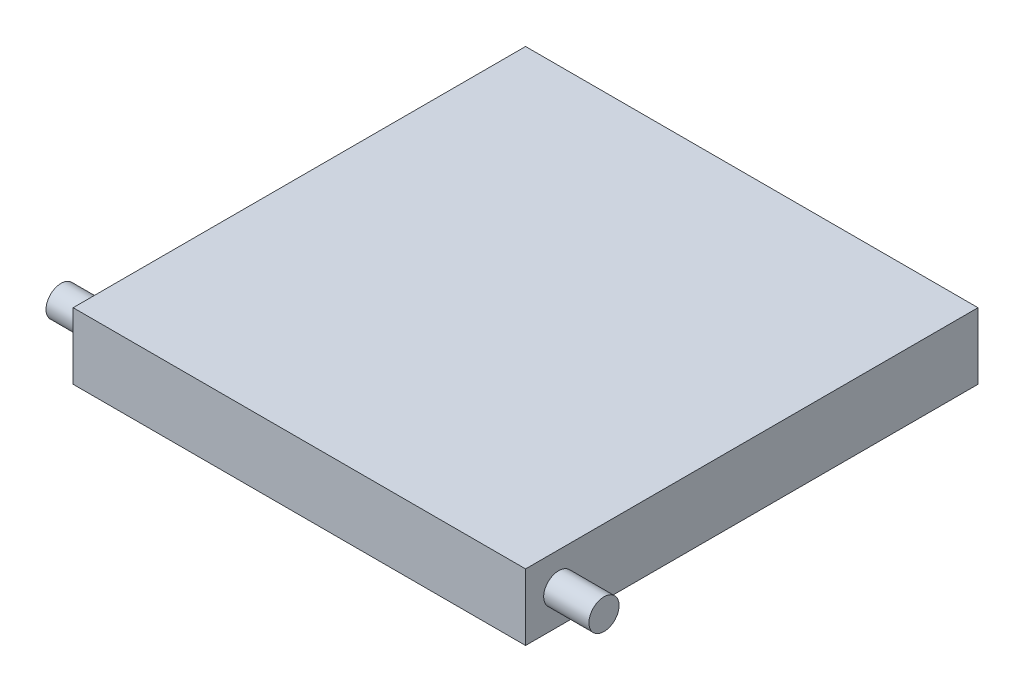
from build123d import *

# Parameters (mm, degrees)
ESQUISSE1_W        = 150
ESQUISSE1_H        = 150
BOSS_EXTRU_1_DEPTH = 22
BOSS_EXTRU_2_DEPTH = 15
BOSS_EXTRU_3_START = 15
ESQUISSE6_R        = 5
BOSS_EXTRU_3_DEPTH = 15


with BuildPart() as part:
    # Esquisse1 → Boss.-Extru.1 (new body)
    with BuildSketch(Plane(origin=(0, 0, 0), x_dir=(1, 0, 0), z_dir=(0, 1, 0))):
        Rectangle(ESQUISSE1_W, ESQUISSE1_H)
    extrude(amount=BOSS_EXTRU_1_DEPTH)

    # Esquisse2 → Boss.-Extru.2 (add)
    with BuildSketch(Plane(origin=(75, 0, 0), x_dir=(0, 0, -1), z_dir=(1, 0, 0))):
        with BuildLine():
            ThreePointArc((-64, 16), (-69, 11), (-64, 6))
            Line((-64, 6), (-64, 16))
        make_face()
        with BuildLine():
            Line((-64, 16), (-64, 6))
            ThreePointArc((-64, 6), (-60.464466094, 7.464466094), (-59, 11))
            ThreePointArc((-59, 11), (-60.464466094, 14.535533906), (-64, 16))
        make_face()
    extrude(amount=BOSS_EXTRU_2_DEPTH)

    # Esquisse6 → Boss.-Extru.3 (add)
    with BuildSketch(Plane.ZY.offset(75).offset(BOSS_EXTRU_3_START)):
        with Locations((64, 11)):
            Circle(ESQUISSE6_R)
    extrude(amount=-BOSS_EXTRU_3_DEPTH)


solid = part.part
